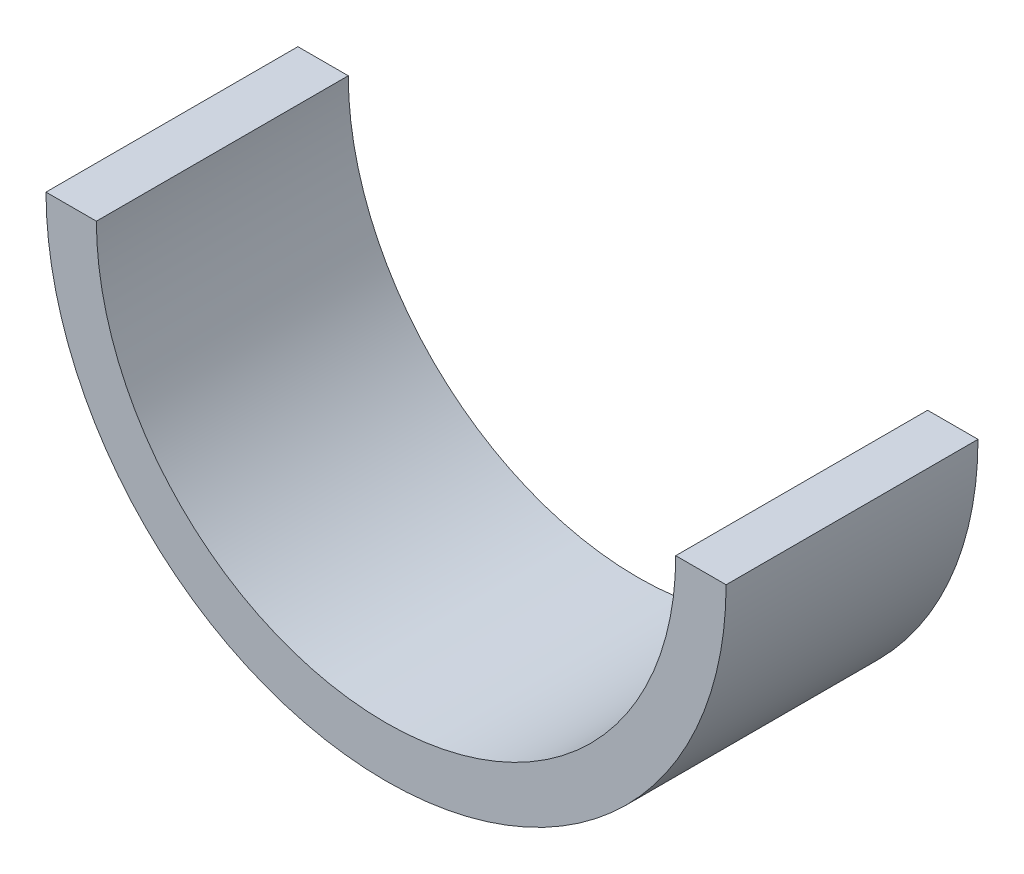
from build123d import *

# Parameters (mm, degrees)
PROFILE_DEPTH = 20


with BuildPart() as part:
    # Sketch1 → Profile (new body)
    with BuildSketch(Plane.XY):
        with BuildLine():
            Line((54, 27), (50, 27))
            ThreePointArc((50, 27), (27, 4), (4, 27))
            Line((4, 27), (0, 27))
            ThreePointArc((0, 27), (27, 0), (54, 27))
        make_face()
    extrude(amount=PROFILE_DEPTH)


solid = part.part
